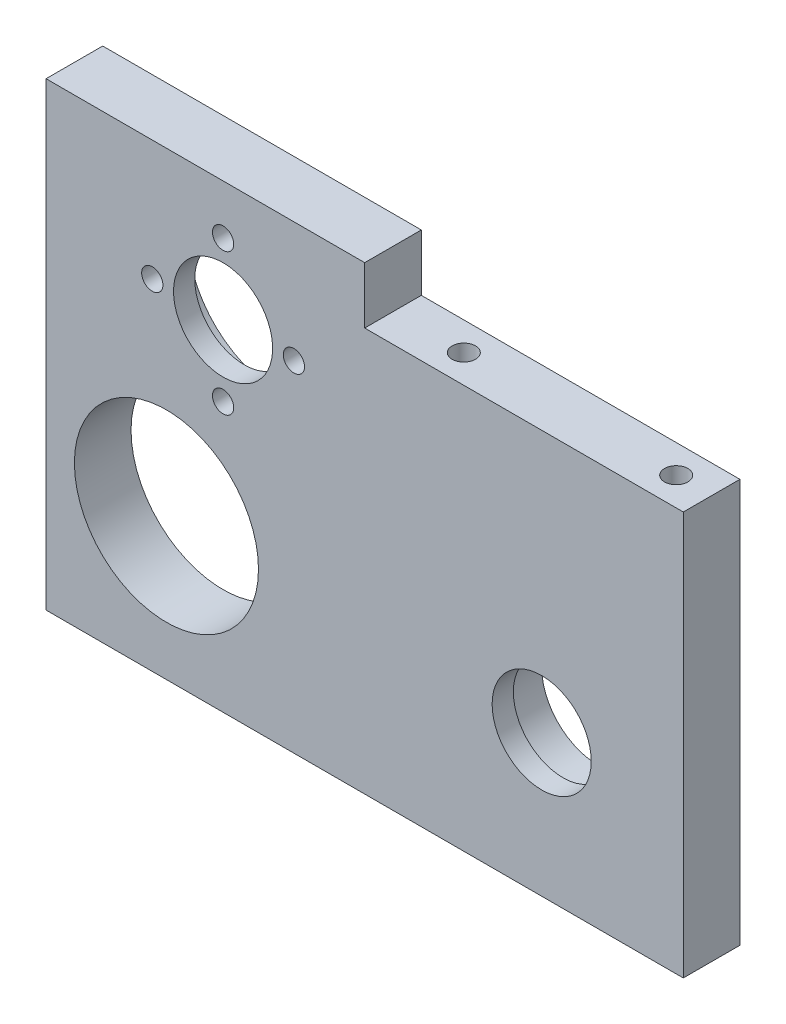
from build123d import *

# Parameters (mm, degrees)
ESQUISSE1_W             = 90
ESQUISSE1_H             = 65
ESQUISSE1_R             = 7
ESQUISSE1_R_2           = 13
BOSS_EXTRU_1_DEPTH      = 8
BOSS_EXTRU_2_START      = -5
ESQUISSE2_R             = 13
BOSS_EXTRU_2_DEPTH      = 3
ESQUISSE3_R             = 7
ESQUISSE3_R_2           = 1.5
ENL_V_MAT_EXTRU_1_DEPTH = 112.130553854
ENL_V_START             = -8
ESQUISSE4_R             = 8
ENL_V_MAT_EXTRU_2_DEPTH = 5
ESQUISSE5_W             = 45
ESQUISSE5_H             = 8
ENL_V_MAT_EXTRU_3_DEPTH = 112.30588484
ESQUISSE6_R             = 1.65
ENL_V_MAT_EXTRU_4_DEPTH = 10
ESQUISSE7_R             = 1.65
ENL_V_MAT_EXTRU_5_DEPTH = 10


with BuildPart() as part:
    # Esquisse1 → Boss.-Extru.1 (new body)
    with BuildSketch(Plane.XY):
        with Locations((45, 32.5)):
            Rectangle(ESQUISSE1_W, ESQUISSE1_H)
        with Locations((70, 20)):
            Circle(ESQUISSE1_R, mode=Mode.SUBTRACT)
        with Locations((17, 20)):
            Circle(ESQUISSE1_R_2, mode=Mode.SUBTRACT)
        with Locations((25, 48)):
            Circle(ESQUISSE1_R_2, mode=Mode.SUBTRACT)
    extrude(amount=BOSS_EXTRU_1_DEPTH)

    # Esquisse2 → Boss.-Extru.2 (add)
    with BuildSketch(Plane(origin=(0, 0, 0), x_dir=(-1, 0, 0), z_dir=(0, 0, -1)).offset(BOSS_EXTRU_2_START)):
        with Locations((-25, 48)):
            Circle(ESQUISSE2_R)
    extrude(amount=-BOSS_EXTRU_2_DEPTH)

    # Esquisse3 → Enlèv. mat.-Extru.1 (cut, through all)
    with BuildSketch(Plane(origin=(0, 0, 5), x_dir=(-1, 0, 0), z_dir=(0, 0, -1))):
        with Locations((-25, 48)):
            Circle(ESQUISSE3_R)
        with Locations((-15, 48)):
            Circle(ESQUISSE3_R_2)
        with Locations((-25, 38)):
            Circle(ESQUISSE3_R_2)
        with Locations((-35, 48)):
            Circle(ESQUISSE3_R_2)
        with Locations((-25, 58)):
            Circle(ESQUISSE3_R_2)
    extrude(amount=-ENL_V_MAT_EXTRU_1_DEPTH, mode=Mode.SUBTRACT)

    # Esquisse4 → Enlèv. mat.-Extru.2 (cut)
    with BuildSketch(Plane.XY.offset(8).offset(ENL_V_START)):
        with Locations(Location((70, 20, 0), (0, 0, 180))):
            Circle(ESQUISSE4_R)
    extrude(amount=ENL_V_MAT_EXTRU_2_DEPTH, mode=Mode.SUBTRACT)

    # Esquisse5 → Enlèv. mat.-Extru.3 (cut, through all)
    with BuildSketch(Plane(origin=(0, 0, 0), x_dir=(-1, 0, 0), z_dir=(0, 0, -1))):
        with Locations((-67.5, 61)):
            Rectangle(ESQUISSE5_W, ESQUISSE5_H)
    extrude(amount=-ENL_V_MAT_EXTRU_3_DEPTH, mode=Mode.SUBTRACT)

    # Esquisse6 → Enlèv. mat.-Extru.4 (cut)
    with BuildSketch(Plane.ZY):
        with Locations((4, 45)):
            Circle(ESQUISSE6_R)
        with Locations((4, 7)):
            Circle(ESQUISSE6_R)
    extrude(amount=-ENL_V_MAT_EXTRU_4_DEPTH, mode=Mode.SUBTRACT)

    # Esquisse7 → Enlèv. mat.-Extru.5 (cut)
    with BuildSketch(Plane(origin=(0, 57, 0), x_dir=(1, 0, 0), z_dir=(0, 1, 0))):
        with Locations(Location((85, -4, 0), (0, 0, 270))):
            Circle(ESQUISSE7_R)
        with Locations(Location((55, -4, 0), (0, 0, 270))):
            Circle(ESQUISSE7_R)
    extrude(amount=-ENL_V_MAT_EXTRU_5_DEPTH, mode=Mode.SUBTRACT)


solid = part.part
